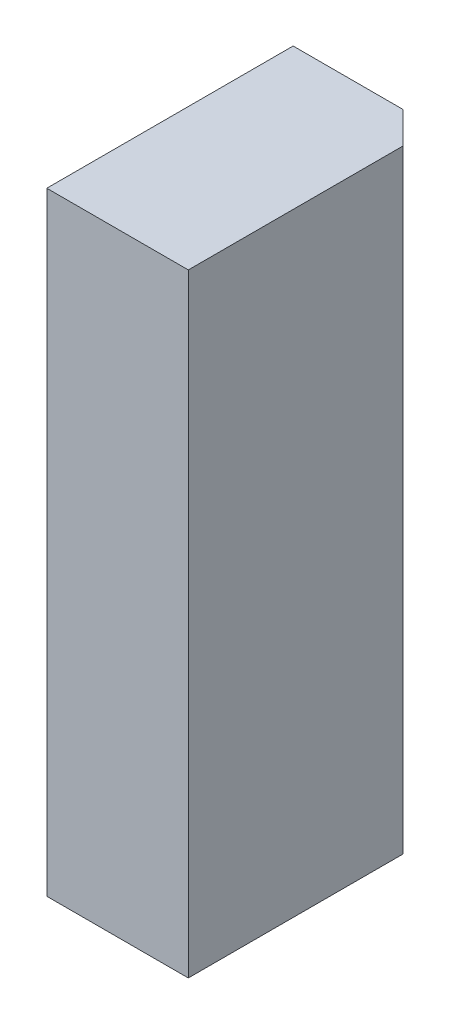
from build123d import *

# Parameters (mm, degrees)
SKETCH_1_W          = 2.7
SKETCH_1_H          = 4.7
EXTRUDE_1_DEPTH     = 11.7
CHAMFER_1_SIZE      = 0.6
CUT_EXTRUDE_2_REACH = 14.235
SKETCH_3_R          = 0.5


with BuildPart() as part:
    # 草圖1 → 伸長1 (new body)
    with BuildSketch(Plane(origin=(0, 0, 0), x_dir=(1, 0, 0), z_dir=(0, 1, 0))):
        Rectangle(SKETCH_1_W, SKETCH_1_H)
    extrude(amount=EXTRUDE_1_DEPTH)

    # 導角1
    chamfer_1_edges = [part.edges().sort_by_distance(p)[0] for p in [
        (1.35, 5.85, -2.35),
    ]]
    chamfer(chamfer_1_edges, length=CHAMFER_1_SIZE)

    # 伸長2: up to this plane
    cut_extrude_2_end = Plane(origin=(0.75, 11.7, -2.35), z_dir=(-0.7071067811865476, 0, 0.7071067811865476))
    # 草圖3 → 伸長2 (cut, up to the surface)
    with BuildSketch(Plane.ZY.offset(1.35), mode=Mode.PRIVATE) as cut_extrude_2_sk1:
        with Locations((-2.45, 1)):
            Circle(SKETCH_3_R)
    cut_extrude_2_tool1 = split(extrude(cut_extrude_2_sk1.sketch, amount=-CUT_EXTRUDE_2_REACH, mode=Mode.PRIVATE), bisect_by=cut_extrude_2_end, keep=Keep.BOTH, mode=Mode.PRIVATE)
    add(cut_extrude_2_tool1.solids().sort_by_distance((-1.35, 1, -2.45))[0], mode=Mode.SUBTRACT)


solid = part.part
